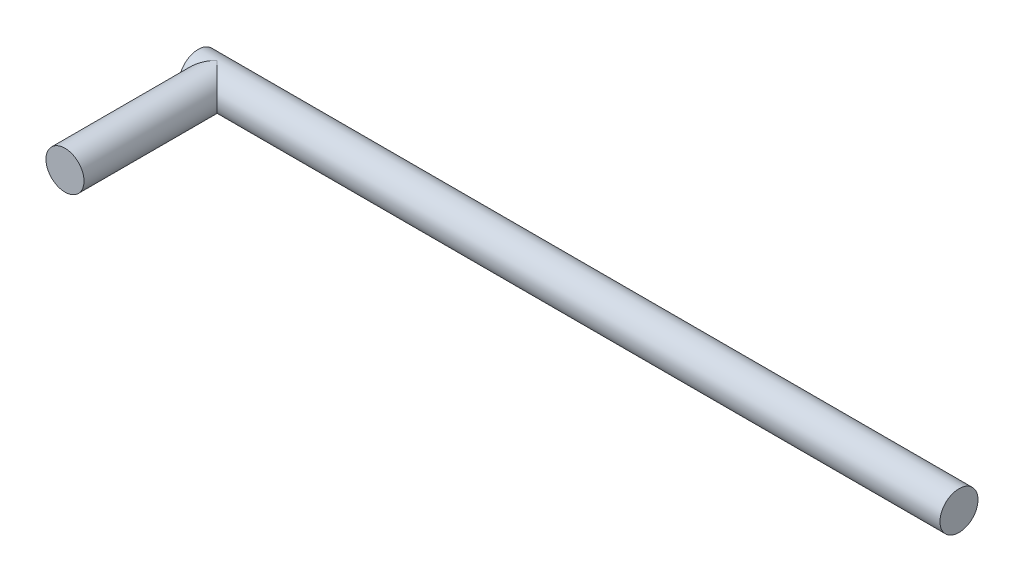
from build123d import *

# Parameters (mm, degrees)
SKETCH2_R           = 1.27
BOSS_EXTRUDE1_DEPTH = 50.8
SKETCH3_R           = 1.27
BOSS_EXTRUDE2_DEPTH = 10.16


with BuildPart() as part:
    # Sketch2 → Boss-Extrude1 (new body)
    with BuildSketch(Plane(origin=(0, 0, 0), x_dir=(0, 0, -1), z_dir=(1, 0, 0))):
        Circle(SKETCH2_R)
    extrude(amount=BOSS_EXTRUDE1_DEPTH)

    # Sketch3 → Boss-Extrude2 (add)
    with BuildSketch(Plane.XY):
        with Locations((1.27, 0)):
            Circle(SKETCH3_R)
    extrude(amount=BOSS_EXTRUDE2_DEPTH)


solid = part.part
